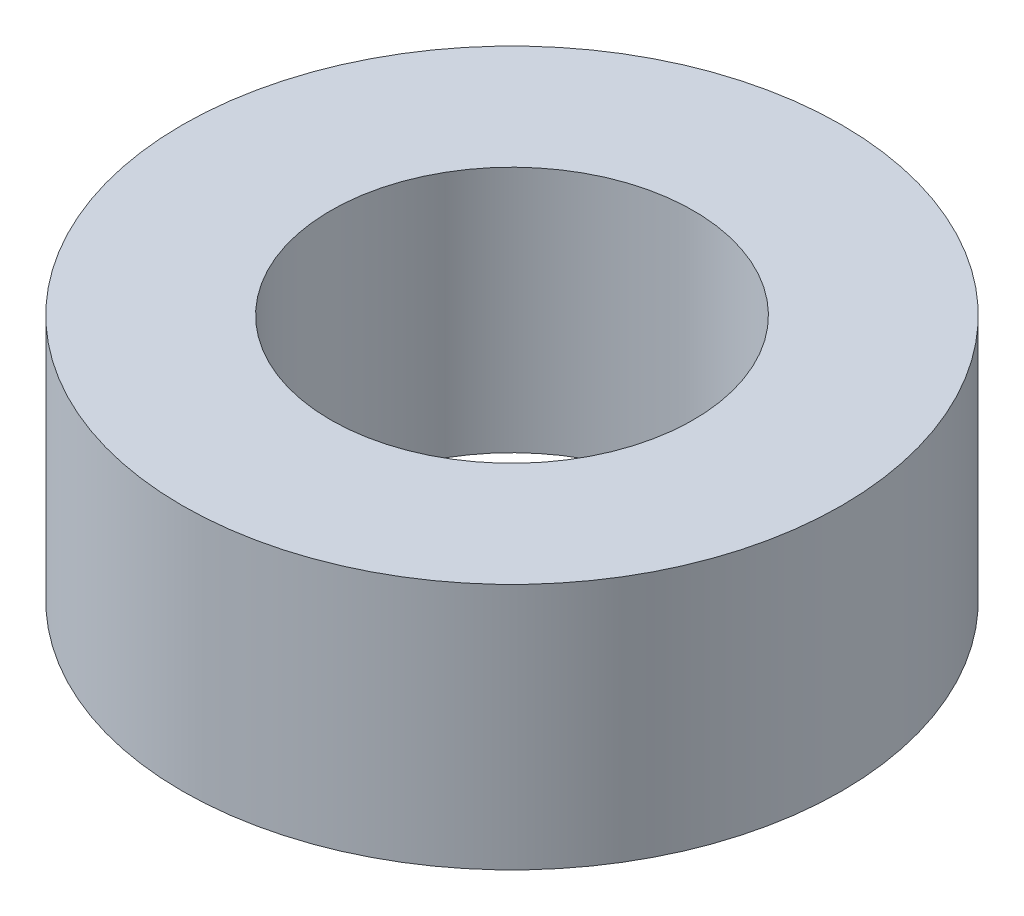
from build123d import *

# Parameters (mm, degrees)
SKETCH1_R           = 2
SKETCH1_R_2         = 1.1
BOSS_EXTRUDE1_DEPTH = 0.75


with BuildPart() as part:
    # Sketch1 → Boss-Extrude1 (new, symmetric)
    with BuildSketch(Plane(origin=(0, 0, 0), x_dir=(1, 0, 0), z_dir=(0, 1, 0))):
        with Locations(Location((0, 0, 0), (0, 0, 270))):
            Circle(SKETCH1_R)
        with Locations(Location((0, 0, 0), (0, 0, 270))):
            Circle(SKETCH1_R_2, mode=Mode.SUBTRACT)
    extrude(amount=BOSS_EXTRUDE1_DEPTH, both=True)


solid = part.part
